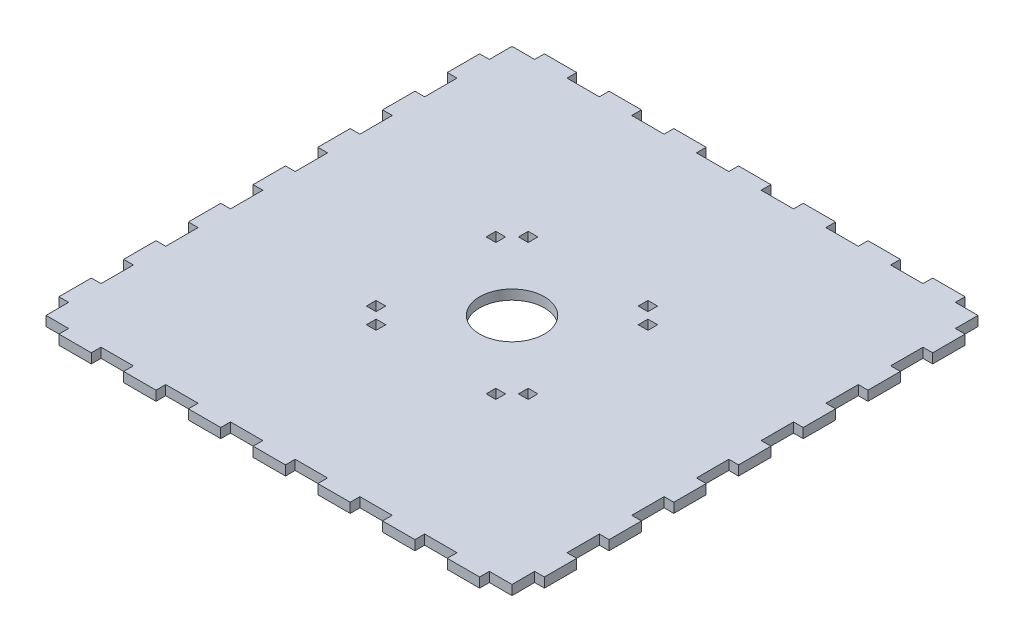
from build123d import *

# Parameters (mm, degrees)
CROQUIS1_R              = 10
CROQUIS1_W              = 3
CROQUIS1_H              = 3
SALIENTE_EXTRUIR2_DEPTH = 3


with BuildPart() as part:
    # Croquis1 → Saliente-Extruir2 (new body)
    with BuildSketch(Plane(origin=(0, 0, 0), x_dir=(1, 0, 0), z_dir=(0, 1, 0))):
        Polygon((-72, -72), (-65, -72), (-65, -75), (-55, -75), (-55, -72), (-45, -72), (-45, -75), (-35, -75), (-35, -72), (-25, -72), (-25, -75), (-15, -75), (-15, -72), (-5, -72), (-5, -75), (5, -75), (5, -72), (15, -72), (15, -75), (25, -75), (25, -72), (35, -72), (35, -75), (45, -75), (45, -72), (55, -72), (55, -75), (65, -75), (65, -72), (72, -72), (72, -65), (75, -65), (75, -55), (72, -55), (72, -45), (75, -45), (75, -35), (72, -35), (72, -25), (75, -25), (75, -15), (72, -15), (72, -5), (75, -5), (75, 5), (72, 5), (72, 15), (75, 15), (75, 25), (72, 25), (72, 35), (75, 35), (75, 45), (72, 45), (72, 55), (75, 55), (75, 65), (72, 65), (72, 72), (65, 72), (65, 75), (55, 75), (55, 72), (45, 72), (45, 75), (35, 75), (35, 72), (25, 72), (25, 75), (15, 75), (15, 72), (5, 72), (5, 75), (-5, 75), (-5, 72), (-15, 72), (-15, 75), (-25, 75), (-25, 72), (-35, 72), (-35, 75), (-45, 75), (-45, 72), (-55, 72), (-55, 75), (-65, 75), (-65, 72), (-72, 72), (-72, 65), (-75, 65), (-75, 55), (-72, 55), (-72, 45), (-75, 45), (-75, 35), (-72, 35), (-72, 25), (-75, 25), (-75, 15), (-72, 15), (-72, 5), (-75, 5), (-75, -5), (-72, -5), (-72, -15), (-75, -15), (-75, -25), (-72, -25), (-72, -35), (-75, -35), (-75, -45), (-72, -45), (-72, -55), (-75, -55), (-75, -65), (-72, -65), align=None)
        with Locations(Location((0, 0, 0), (0, 0, 270))):
            Circle(CROQUIS1_R, mode=Mode.SUBTRACT)
        with Locations((18.5, 23.5)):
            Rectangle(CROQUIS1_W, CROQUIS1_H, mode=Mode.SUBTRACT)
        with Locations((-18.5, 23.5)):
            Rectangle(CROQUIS1_W, CROQUIS1_H, mode=Mode.SUBTRACT)
        with Locations((-23.5, 18.5)):
            Rectangle(CROQUIS1_W, CROQUIS1_H, mode=Mode.SUBTRACT)
        with Locations((-23.5, -18.5)):
            Rectangle(CROQUIS1_W, CROQUIS1_H, mode=Mode.SUBTRACT)
        with Locations((23.5, -18.5)):
            Rectangle(CROQUIS1_W, CROQUIS1_H, mode=Mode.SUBTRACT)
        with Locations((23.5, 18.5)):
            Rectangle(CROQUIS1_W, CROQUIS1_H, mode=Mode.SUBTRACT)
        with Locations((18.5, -23.5)):
            Rectangle(CROQUIS1_W, CROQUIS1_H, mode=Mode.SUBTRACT)
        with Locations((-18.5, -23.5)):
            Rectangle(CROQUIS1_W, CROQUIS1_H, mode=Mode.SUBTRACT)
    extrude(amount=SALIENTE_EXTRUIR2_DEPTH)


solid = part.part
